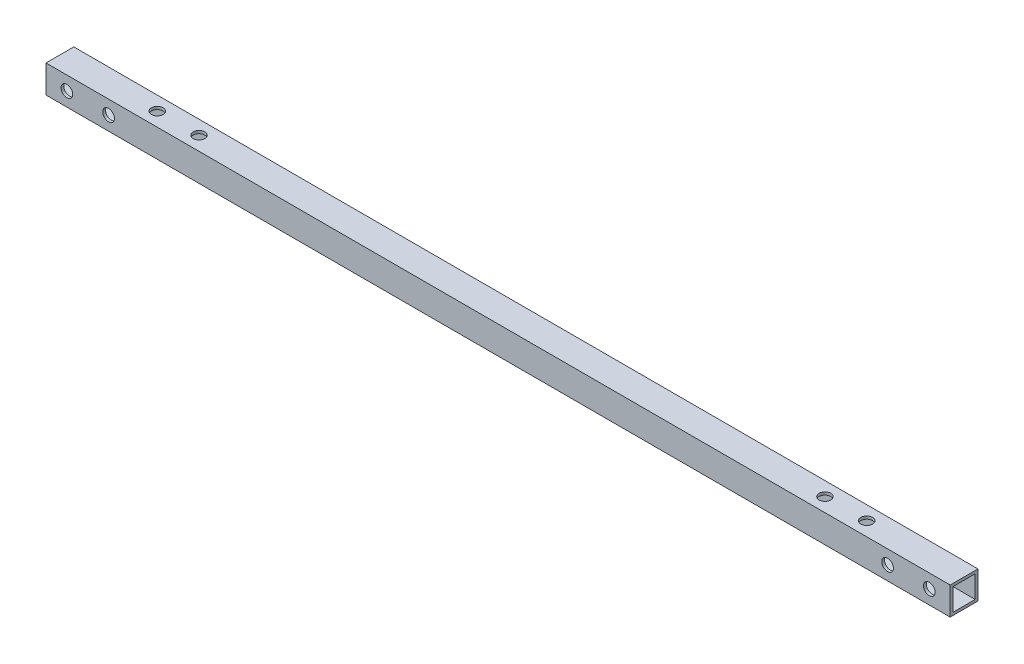
from build123d import *

# Parameters (mm, degrees)
SKETCH_1_W          = 10
SKETCH_1_H          = 10
SKETCH_1_W_2        = 8
SKETCH_1_H_2        = 8
EXTRUDE_1_DEPTH     = 325
SKETCH_2_R          = 2.1
CUT_EXTRUDE_1_DEPTH = 326.19225083
SKETCH_3_R          = 2.1
CUT_EXTRUDE_2_DEPTH = 326.19225083


with BuildPart() as part:
    # ｽｹｯﾁ1 → 押し出し-薄板1 (new body)
    with BuildSketch(Plane(origin=(0, 0, 0), x_dir=(0, 0, -1), z_dir=(1, 0, 0))):
        Rectangle(SKETCH_1_W, SKETCH_1_H)
        Rectangle(SKETCH_1_W_2, SKETCH_1_H_2, mode=Mode.SUBTRACT)
    extrude(amount=EXTRUDE_1_DEPTH)

    # ｽｹｯﾁ2 → ｶｯﾄ - 押し出し1 (cut, through all)
    with BuildSketch(Plane.XY.offset(5)):
        with Locations((22.5, 0)):
            Circle(SKETCH_2_R)
        with Locations((7.5, 0)):
            Circle(SKETCH_2_R)
        with Locations(Location((317.5, 0, 0), (0, 0, 90))):
            Circle(SKETCH_2_R)
        with Locations(Location((302.5, 0, 0), (0, 0, 90))):
            Circle(SKETCH_2_R)
    extrude(amount=-CUT_EXTRUDE_1_DEPTH, mode=Mode.SUBTRACT)

    # ｽｹｯﾁ3 → ｶｯﾄ - 押し出し2 (cut, through all)
    with BuildSketch(Plane(origin=(0, 5, 0), x_dir=(1, 0, 0), z_dir=(0, 1, 0))):
        with Locations(Location((275, 0, 0), (0, 0, 270))):
            Circle(SKETCH_3_R)
        with Locations(Location((290, 0, 0), (0, 0, 270))):
            Circle(SKETCH_3_R)
        with Locations(Location((35, 0, 0), (0, 0, 270))):
            Circle(SKETCH_3_R)
        with Locations(Location((50, 0, 0), (0, 0, 270))):
            Circle(SKETCH_3_R)
    extrude(amount=-CUT_EXTRUDE_2_DEPTH, mode=Mode.SUBTRACT)


solid = part.part
